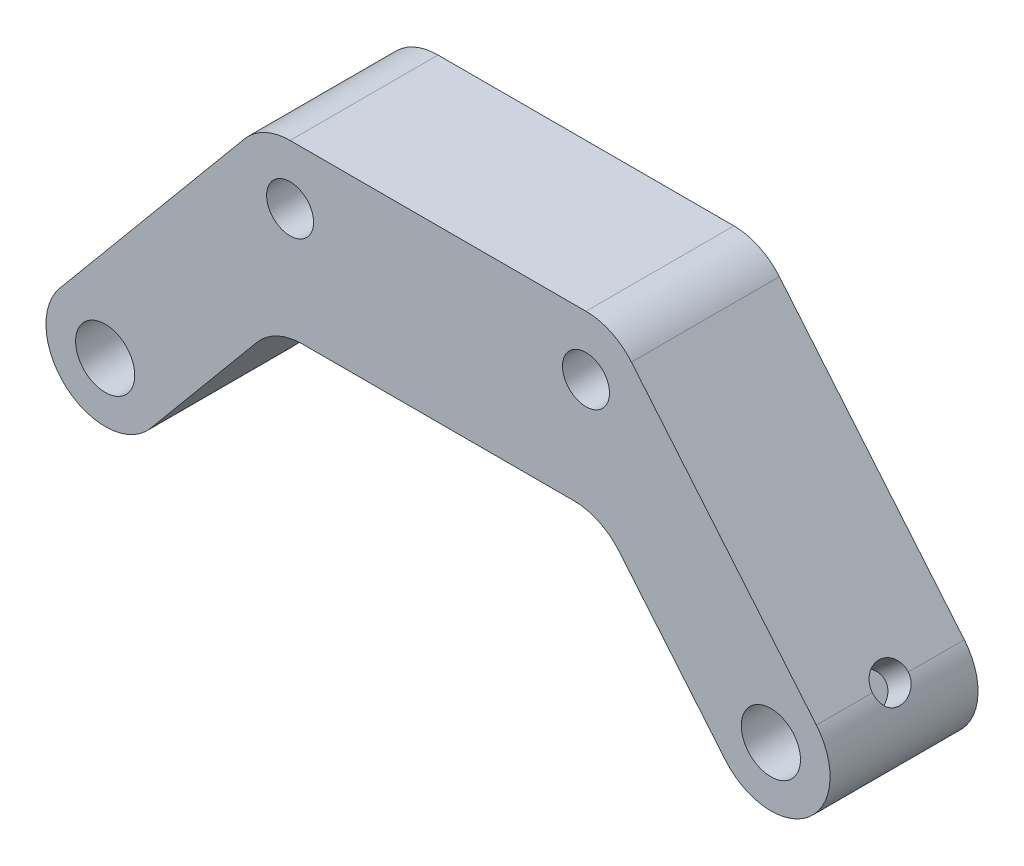
from build123d import *

# Parameters (mm, degrees)
BOSS_EXTRUDE1_DEPTH = 20
SKETCH2_R           = 4
CUT_EXTRUDE1_DEPTH  = 15
SKETCH6_R           = 2.425
CUT_EXTRUDE5_DEPTH  = 6
CUT_EXTRUDE6_REACH  = 70.213
SKETCH7_R           = 3.175


with BuildPart() as part:
    # Sketch1 → Boss-Extrude1 (new body)
    with BuildSketch(Plane.XY):
        with BuildLine():
            Line((-26.145770237, 35.121475197), (-51.145770237, 5.121475197))
            ThreePointArc((-51.145770237, 5.121475197), (-50.121475197, -6.145770237), (-38.854229763, -5.121475197))
            Line((-38.854229763, -5.121475197), (-24.485104434, 12.121475197))
            ThreePointArc((-24.485104434, 12.121475197), (-21.732577368, 14.24471537), (-18.339334198, 15))
            Line((-18.339334198, 15), (18.339334198, 15))
            ThreePointArc((18.339334198, 15), (21.732577368, 14.24471537), (24.485104434, 12.121475197))
            Line((24.485104434, 12.121475197), (38.854229763, -5.121475197))
            ThreePointArc((38.854229763, -5.121475197), (50.121475197, -6.145770237), (51.145770237, 5.121475197))
            Line((51.145770237, 5.121475197), (26.145770237, 35.121475197))
            ThreePointArc((26.145770237, 35.121475197), (23.39324317, 37.24471537), (20, 38))
            Line((20, 38), (-20, 38))
            ThreePointArc((-20, 38), (-23.39324317, 37.24471537), (-26.145770237, 35.121475197))
        make_face()
    extrude(amount=BOSS_EXTRUDE1_DEPTH)

    # Sketch2 → Cut-Extrude1 (cut)
    with BuildSketch(Plane.XY.offset(20)):
        with Locations((-45, 0)):
            Circle(SKETCH2_R)
        with Locations((44.995948223, 0)):
            Circle(SKETCH2_R)
    extrude(amount=-CUT_EXTRUDE1_DEPTH, mode=Mode.SUBTRACT)

    # Sketch6 → Cut-Extrude5 (cut)
    with BuildSketch(Plane(origin=(-32.703147286, 27.252622738, 0), x_dir=(0, 0, 1), z_dir=(-0.7682212795973757, 0.6401843996644799, 0))):
        with Locations(Location((10, -28.808297985, 0), (0, 0, 270))):
            Circle(SKETCH6_R)
    cut_extrude5 = extrude(amount=-CUT_EXTRUDE5_DEPTH, mode=Mode.SUBTRACT)

    # Mirror2: Cut-Extrude5 across plane
    add(cut_extrude5.mirror(Plane(origin=(0, 0, 0), x_dir=(0, 0, 1), z_dir=(1, 0, 0))), mode=Mode.SUBTRACT)

    # Sketch7 → Cut-Extrude6 (cut, up to next)
    with BuildSketch(Plane.XY.offset(20), mode=Mode.PRIVATE) as cut_extrude6_sk1:
        with Locations((-20, 30)):
            Circle(SKETCH7_R)
    cut_extrude6_tool1 = extrude(cut_extrude6_sk1.sketch, amount=-CUT_EXTRUDE6_REACH, mode=Mode.PRIVATE) & part.part
    # Sketch7 → Cut-Extrude6 (cut, up to next)
    with BuildSketch(Plane.XY.offset(20), mode=Mode.PRIVATE) as cut_extrude6_sk2:
        with Locations((20, 30)):
            Circle(SKETCH7_R)
    cut_extrude6_tool2 = extrude(cut_extrude6_sk2.sketch, amount=-CUT_EXTRUDE6_REACH, mode=Mode.PRIVATE) & part.part
    add(cut_extrude6_tool1.solids().sort_by_distance((-20, 30, 20))[0], mode=Mode.SUBTRACT)
    add(cut_extrude6_tool2.solids().sort_by_distance((20, 30, 20))[0], mode=Mode.SUBTRACT)


solid = part.part
